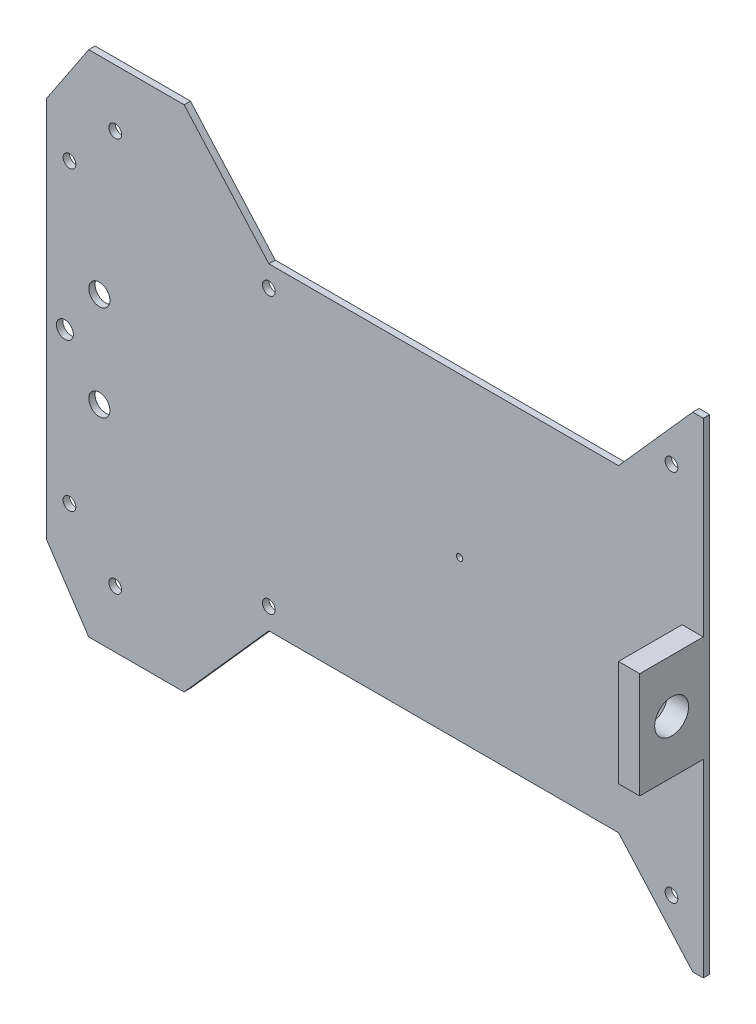
from build123d import *

# Parameters (mm, degrees)
SKETCH_1_R           = 3
SKETCH_1_W           = 90
SKETCH_1_H           = 120
SKETCH_1_R_2         = 10
SKETCH_1_R_3         = 7.5
EXTRUDE_2_DEPTH      = 3
EXTRUDE_START        = -10
SKETCH_2_R           = 7.5
EXTRUDE_3_DEPTH      = 10
CUT_EXTRUDE_1_DEPTH  = 10
EXTRUDE_START_2      = -3
SKETCH_4_R           = 10
EXTRUDE_4_DEPTH      = 3
SKETCH_6_W           = 7
SKETCH_6_H           = 14.142135624
CUT_EXTRUDE_5_DEPTH  = 333.489097566
SKETCH_7_W           = 90
SKETCH_7_H           = 120
EXTRUDE_5_DEPTH      = 3
SKETCH_8_W           = 10
SKETCH_8_H           = 50
EXTRUDE_6_DEPTH      = 30
SKETCH_9_R           = 8
CUT_EXTRUDE_6_DEPTH  = 30
SKETCH_10_R          = 3
EXTRUDE_7_DEPTH      = 3
SKETCH_11_R          = 3
CUT_EXTRUDE_7_DEPTH  = 3
SKETCH_12_R          = 3
EXTRUDE_8_DEPTH      = 3
SKETCH_13_R          = 3
CUT_EXTRUDE_8_DEPTH  = 3
SKETCH_14_R          = 3
CUT_EXTRUDE_9_DEPTH  = 10
SKETCH_15_R          = 3
CUT_EXTRUDE_10_DEPTH = 231.922064775
SKETCH_16_R          = 3
EXTRUDE_10_DEPTH     = 3
SKETCH_17_R          = 3
CUT_EXTRUDE_11_DEPTH = 231.922064775
SKETCH_18_R          = 5
CUT_EXTRUDE_12_DEPTH = 10
SKETCH_20_R          = 1.5
CUT_EXTRUDE_13_DEPTH = 10
CUT_EXTRUDE_14_DEPTH = 10


with BuildPart() as part:
    # 草图1 → 凸台-拉伸2 (new body)
    # profile 1 of 9: a face of its own
    with BuildSketch(Plane.XY):
        Polygon((195, -115), (195, 115), (190, 115), (190, 120), (115, 120), (115, 75), (75, 75), (-90, 75), (-130, 75), (-130, 120), (-175, 120), (-175, 90), (-195, 90), (-195, -90), (-175, -90), (-175, -120), (-130, -120), (-130, -75), (-90, -75), (75, -75), (115, -75), (115, -120), (190, -120), (190, -115), align=None)
        with Locations((-184.089468205, -70)):
            Circle(SKETCH_1_R, mode=Mode.SUBTRACT)
        with Locations((-87, -69)):
            Circle(SKETCH_1_R, mode=Mode.SUBTRACT)
        with Locations((-184.089468205, 70)):
            Circle(SKETCH_1_R, mode=Mode.SUBTRACT)
        with Locations((-87, 69)):
            Circle(SKETCH_1_R, mode=Mode.SUBTRACT)
        Rectangle(SKETCH_1_W, SKETCH_1_H, mode=Mode.SUBTRACT)
        with Locations((75, 0)):
            Circle(SKETCH_1_R_2, mode=Mode.SUBTRACT)
        with Locations((117.5, 0)):
            Circle(SKETCH_1_R_3, mode=Mode.SUBTRACT)
    # profile 2 of 9: a face of its own
    with BuildSketch(Plane.XY):
        Polygon((-130, 120), (-90, 75), (-130, 75), align=None)
    # profile 3 of 9: a face of its own
    with BuildSketch(Plane.XY):
        Polygon((-175, 120), (-175, 90), (-195, 90), align=None)
    # profile 4 of 9: a face of its own
    with BuildSketch(Plane.XY):
        Polygon((-175, -120), (-195, -90), (-175, -90), align=None)
    # profile 5 of 9: a face of its own
    with BuildSketch(Plane.XY):
        Polygon((-130, -120), (-130, -75), (-90, -75), align=None)
    # profile 6 of 9: a face of its own
    with BuildSketch(Plane.XY):
        Polygon((115, -120), (75, -75), (115, -75), align=None)
        with Locations((104.379549532, -93)):
            Circle(SKETCH_1_R, mode=Mode.SUBTRACT)
    # profile 7 of 9: a face of its own
    with BuildSketch(Plane.XY):
        Polygon((115, 120), (115, 75), (75, 75), align=None)
        with Locations((104.379549532, 93)):
            Circle(SKETCH_1_R, mode=Mode.SUBTRACT)
    # profile 8 of 9: a face of its own
    with BuildSketch(Plane.XY):
        Polygon((190, 120), (195, 115), (190, 115), align=None)
    # profile 9 of 9: a face of its own
    with BuildSketch(Plane.XY):
        Polygon((190, -115), (190, -120), (195, -115), align=None)
    extrude(amount=EXTRUDE_2_DEPTH)

    # 草图2 → 凸台-拉伸3 (add)
    with BuildSketch(Plane.XY.offset(3).offset(EXTRUDE_START)):
        with Locations((117.5, 0)):
            Circle(SKETCH_2_R)
    extrude(amount=EXTRUDE_3_DEPTH)

    # 草图3 → 切除-拉伸1 (cut)
    with BuildSketch(Plane.XY.offset(3)):
        Polygon((115, 120), (115, -120), (190, -120), (195, -115), (195, 115), (190, 120), align=None)
        Polygon((115, -120), (115, -114.375), (110, -114.375), align=None)
        Polygon((115, 114.376866735), (115, 120), (110.00165932, 114.376866735), align=None)
    extrude(amount=-CUT_EXTRUDE_1_DEPTH, mode=Mode.SUBTRACT)

    # 草图4 → 凸台-拉伸4 (add)
    with BuildSketch(Plane.XY.offset(3).offset(EXTRUDE_START_2)):
        with Locations((75, 0)):
            Circle(SKETCH_4_R)
    extrude(amount=EXTRUDE_4_DEPTH)

    # 草图6 → 切除-拉伸5 (cut, through all)
    with BuildSketch(Plane(origin=(115, 0, 0), x_dir=(0, 0, -1), z_dir=(1, 0, 0))):
        with Locations((3.5, 0)):
            Rectangle(SKETCH_6_W, SKETCH_6_H)
    extrude(amount=-CUT_EXTRUDE_5_DEPTH, mode=Mode.SUBTRACT)

    # 草图7 → 凸台-拉伸5 (add)
    with BuildSketch(Plane.XY.offset(3)):
        Rectangle(SKETCH_7_W, SKETCH_7_H)
    extrude(amount=-EXTRUDE_5_DEPTH)

    # 草图8 → 凸台-拉伸6 (add)
    with BuildSketch(Plane.XY.offset(3)):
        with Locations((110, 0)):
            Rectangle(SKETCH_8_W, SKETCH_8_H)
    extrude(amount=EXTRUDE_6_DEPTH)

    # 草图9 → 切除-拉伸6 (cut)
    with BuildSketch(Plane(origin=(115, 0, 0), x_dir=(0, 0, -1), z_dir=(1, 0, 0))):
        with Locations((-17.93158575, 0)):
            Circle(SKETCH_9_R)
    extrude(amount=-CUT_EXTRUDE_6_DEPTH, mode=Mode.SUBTRACT)

    # 草图10 → 凸台-拉伸7 (add)
    with BuildSketch(Plane.XY.offset(3).offset(EXTRUDE_START_2)):
        with Locations((104.379549532, -93)):
            Circle(SKETCH_10_R)
        with Locations((104.379549532, 93)):
            Circle(SKETCH_10_R)
    extrude(amount=EXTRUDE_7_DEPTH)

    # 草图11 → 切除-拉伸7 (cut)
    with BuildSketch(Plane.XY.offset(3)):
        with Locations((100, -88.073006777)):
            Circle(SKETCH_11_R)
        with Locations(Location((100, 88.073006777, 0), (0, 0, 180))):
            Circle(SKETCH_11_R)
    extrude(amount=-CUT_EXTRUDE_7_DEPTH, mode=Mode.SUBTRACT)

    # 草图12 → 凸台-拉伸8 (add)
    with BuildSketch(Plane.XY.offset(3).offset(EXTRUDE_START_2)):
        with Locations((-87, 69)):
            Circle(SKETCH_12_R)
        with Locations((-87, -69)):
            Circle(SKETCH_12_R)
    extrude(amount=EXTRUDE_8_DEPTH)

    # 草图13 → 切除-拉伸8 (cut)
    with BuildSketch(Plane.XY.offset(3)):
        with Locations((-90, 65)):
            Circle(SKETCH_13_R)
        with Locations(Location((-90, -65, 0), (0, 0, 180))):
            Circle(SKETCH_13_R)
    extrude(amount=-CUT_EXTRUDE_8_DEPTH, mode=Mode.SUBTRACT)

    # 草图14 → 切除-拉伸9 (cut)
    with BuildSketch(Plane.XY.offset(3)):
        with BuildLine():
            ThreePointArc((-159.5, 88), (-160.378679656, 90.121320344), (-162.5, 91))
            Line((-162.5, 91), (-162.5, 85))
            ThreePointArc((-162.5, 85), (-160.378679656, 85.878679656), (-159.5, 88))
        make_face()
        with BuildLine():
            Line((-162.5, 85), (-162.5, 91))
            ThreePointArc((-162.5, 91), (-165.5, 88), (-162.5, 85))
        make_face()
        with Locations((-162.5, -88)):
            Circle(SKETCH_14_R)
    extrude(amount=-CUT_EXTRUDE_9_DEPTH, mode=Mode.SUBTRACT)

    # 草图15 → 切除-拉伸10 (cut, through all)
    with BuildSketch(Plane.XY.offset(3)):
        with Locations((-162.5, -93)):
            Circle(SKETCH_15_R)
        with Locations((-162.5, -88)):
            Circle(SKETCH_15_R)
        with Locations((-162.5, 93)):
            Circle(SKETCH_15_R)
        with Locations((-162.5, 88)):
            Circle(SKETCH_15_R)
    extrude(amount=-CUT_EXTRUDE_10_DEPTH, mode=Mode.SUBTRACT)

    # 草图16 → 凸台-拉伸10 (add)
    with BuildSketch(Plane.XY.offset(3)):
        with Locations((-162.5, 88)):
            Circle(SKETCH_16_R)
        with Locations((-162.5, -88)):
            Circle(SKETCH_16_R)
    extrude(amount=-EXTRUDE_10_DEPTH)

    # 草图17 → 切除-拉伸11 (cut, through all)
    with BuildSketch(Plane.XY.offset(3)):
        with Locations((-162.5, 93)):
            Circle(SKETCH_17_R)
        with Locations((-162.5, -93)):
            Circle(SKETCH_17_R)
    extrude(amount=-CUT_EXTRUDE_11_DEPTH, mode=Mode.SUBTRACT)

    # 草图18 → 切除-拉伸12 (cut)
    with BuildSketch(Plane.XY.offset(3)):
        with Locations((-170, 22.5)):
            Circle(SKETCH_18_R)
        with Locations((-170, -22.5)):
            Circle(SKETCH_18_R)
    extrude(amount=-CUT_EXTRUDE_12_DEPTH, mode=Mode.SUBTRACT)

    # 草图20 → 切除-拉伸13 (cut)
    with BuildSketch(Plane.XY.offset(3)):
        Circle(SKETCH_20_R)
    extrude(amount=-CUT_EXTRUDE_13_DEPTH, mode=Mode.SUBTRACT)

    # 草图21 → 切除-拉伸14 (cut)
    with BuildSketch(Plane.XY.offset(3)):
        with BuildLine():
            ThreePointArc((-182.25, 0), (-183.421572875, 2.828427125), (-186.25, 4))
            Line((-186.25, 4), (-186.25, -4))
            ThreePointArc((-186.25, -4), (-183.421572875, -2.828427125), (-182.25, 0))
        make_face()
        with BuildLine():
            Line((-186.25, -4), (-186.25, 4))
            ThreePointArc((-186.25, 4), (-190.25, 0), (-186.25, -4))
        make_face()
    extrude(amount=-CUT_EXTRUDE_14_DEPTH, mode=Mode.SUBTRACT)


solid = part.part
